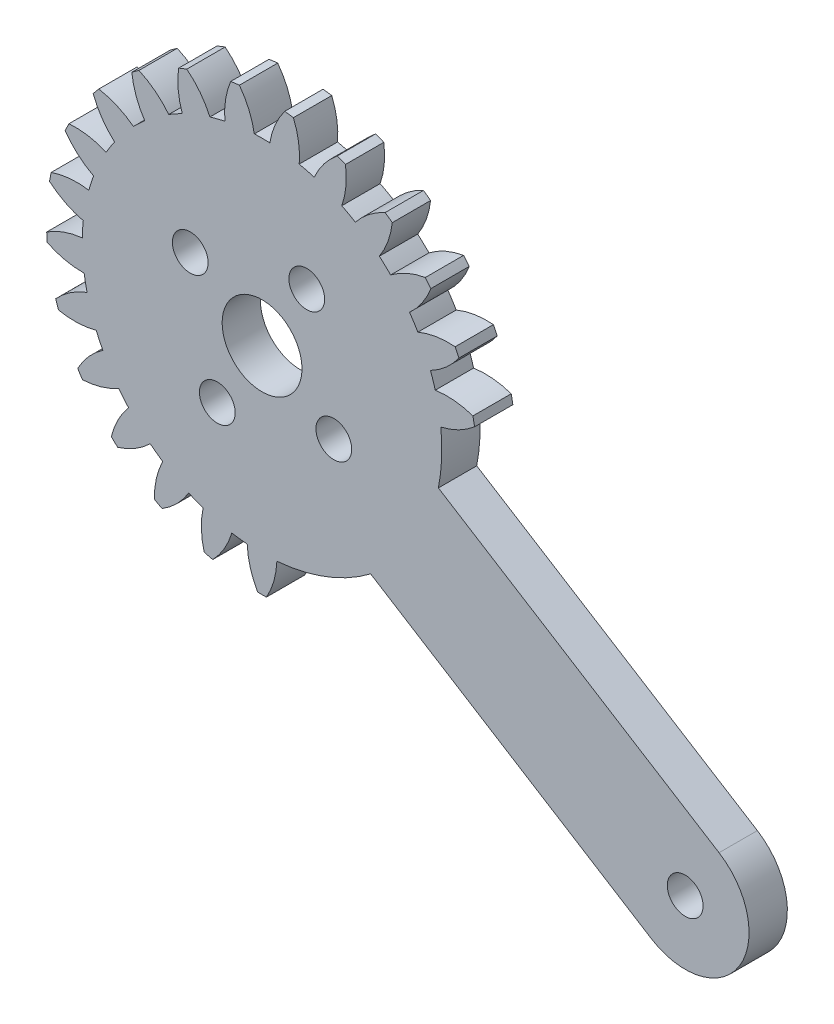
from build123d import *

# Parameters (mm, degrees)
MODEL_R             = 3.175
BOSS_EXTRUDE1_DEPTH = 3.048
SKETCH2_R           = 1.4224
BOSS_EXTRUDE2_DEPTH = 3.048
SKETCH3_R           = 1.4224
SKETCH3_R_2         = 0.475
CUT_EXTRUDE1_DEPTH  = 47.828124767


with BuildPart() as part:
    # Model → Boss-Extrude1 (new body)
    with BuildSketch(Plane.XY):
        with BuildLine():
            ThreePointArc((-0.616026415, 14.286925194), (-1.042592722, 15.739677645), (-1.800954663, 17.050149187))
            ThreePointArc((-1.800954663, 17.050149187), (-2.148838289, 17.009806554), (-2.495825317, 16.962366609))
            ThreePointArc((-2.495825317, 16.962366609), (-2.904460903, 15.504468994), (-2.956341002, 13.991274707))
            ThreePointArc((-2.956341002, 13.991274707), (-3.556315124, 13.850932921), (-4.149686627, 13.684875627))
            ThreePointArc((-4.149686627, 13.684875627), (-4.924136412, 14.985904462), (-5.984574038, 16.066608185))
            ThreePointArc((-5.984574038, 16.066608185), (-6.311495456, 15.941017851), (-6.635783413, 15.808776154))
            ThreePointArc((-6.635783413, 15.808776154), (-6.669016568, 14.295057536), (-6.342950641, 12.816500973))
            ThreePointArc((-6.342950641, 12.816500973), (-6.88917389, 12.531360786), (-7.422606766, 12.222954996))
            ThreePointArc((-7.422606766, 12.222954996), (-8.496278501, 13.290511787), (-9.792160616, 14.073543103))
            ThreePointArc((-9.792160616, 14.073543103), (-10.077578151, 13.870596369), (-10.358790833, 13.661862153))
            ThreePointArc((-10.358790833, 13.661862153), (-10.014533394, 12.187435039), (-9.331009364, 10.836419348))
            ThreePointArc((-9.331009364, 10.836419348), (-9.789160524, 10.424397166), (-10.229137224, 9.993021149))
            ThreePointArc((-10.229137224, 9.993021149), (-11.534568165, 10.760027378), (-12.98446973, 11.196185548))
            ThreePointArc((-12.98446973, 11.196185548), (-13.210449547, 10.928634304), (-13.430917328, 10.656523107))
            ThreePointArc((-13.430917328, 10.656523107), (-12.730800257, 9.314031176), (-11.732766451, 8.175445642))
            ThreePointArc((-11.732766451, 8.175445642), (-12.0740582, 7.662430334), (-12.39293337, 7.135189032))
            ThreePointArc((-12.39293337, 7.135189032), (-13.84809849, 7.553450876), (-15.360916858, 7.615330478))
            ThreePointArc((-15.360916858, 7.615330478), (-15.513259815, 7.299985954), (-15.659129891, 6.981595523))
            ThreePointArc((-15.659129891, 6.981595523), (-14.647144119, 5.85539248), (-13.397310672, 5.000778618))
            ThreePointArc((-13.397310672, 5.000778618), (-13.600298394, 4.419004823), (-13.778035935, 3.829026746))
            ThreePointArc((-13.778035935, 3.829026746), (-15.291501858, 3.872263276), (-16.772181085, 3.555976188))
            ThreePointArc((-16.772181085, 3.555976188), (-16.841314914, 3.212652639), (-16.903421733, 2.867988616))
            ThreePointArc((-16.903421733, 2.867988616), (-15.643154047, 2.02883794), (-14.220052592, 1.511894283))
            ThreePointArc((-14.220052592, 1.511894283), (-14.271981822, 0.897916987), (-14.297413829, 0.282272628))
            ThreePointArc((-14.297413829, 0.282272628), (-15.774083925, -0.052232867), (-17.129587491, -0.726813165))
            ThreePointArc((-17.129587491, -0.726813165), (-17.111168259, -1.076543457), (-17.085609422, -1.425824564))
            ThreePointArc((-17.085609422, -1.425824564), (-15.656247076, -1.92519595), (-14.14929631, -2.071987931))
            ThreePointArc((-14.14929631, -2.071987931), (-14.046904143, -2.679590275), (-13.918432631, -3.282217718))
            ThreePointArc((-13.918432631, -3.282217718), (-15.265522286, -3.973447027), (-16.410678917, -4.963934173))
            ThreePointArc((-16.410678917, -4.963934173), (-16.305863972, -5.298096369), (-16.194245434, -5.630047943))
            ThreePointArc((-16.194245434, -5.630047943), (-14.68560052, -5.758262697), (-13.189487703, -5.525679522))
            ThreePointArc((-13.189487703, -5.525679522), (-12.939207816, -6.088729025), (-12.664905121, -6.640474253))
            ThreePointArc((-12.664905121, -6.640474253), (-13.797771739, -7.644994897), (-14.660627033, -8.889152941))
            ThreePointArc((-14.660627033, -8.889152941), (-14.476002283, -9.1867504), (-14.285337446, -9.480514703))
            ThreePointArc((-14.285337446, -9.480514703), (-12.792203675, -9.229516622), (-11.400935076, -8.632172348))
            ThreePointArc((-11.400935076, -8.632172348), (-11.018493474, -9.115290538), (-10.615595045, -9.581485369))
            ThreePointArc((-10.615595045, -9.581485369), (-11.46305645, -10.836179621), (-11.989394033, -12.255833538))
            ThreePointArc((-11.989394033, -12.255833538), (-11.736560131, -12.498167117), (-11.47882917, -12.735285858))
            ThreePointArc((-11.47882917, -12.735285858), (-10.095025626, -12.120846074), (-8.896019768, -11.196274037))
            ThreePointArc((-8.896019768, -11.196274037), (-8.405446665, -11.569104823), (-7.899268091, -11.920456521))
            ThreePointArc((-7.899268091, -11.920456521), (-8.408075165, -13.346487327), (-8.564823313, -14.85243504))
            ThreePointArc((-8.564823313, -14.85243504), (-8.259666742, -15.024278029), (-7.95106384, -15.189852165))
            ThreePointArc((-7.95106384, -15.189852165), (-6.76353999, -14.25057819), (-5.832134822, -13.056872652))
            ThreePointArc((-5.832134822, -13.056872652), (-5.264254728, -13.295989703), (-4.686601071, -13.510421549))
            ThreePointArc((-4.686601071, -13.510421549), (-4.824783595, -15.018186149), (-4.602093245, -16.515803425))
            ThreePointArc((-4.602093245, -16.515803425), (-4.263788115, -16.606358298), (-3.923703928, -16.689984197))
            ThreePointArc((-3.923703928, -16.689984197), (-3.007076261, -15.484894068), (-2.401795395, -14.097059939))
            ThreePointArc((-2.401795395, -14.097059939), (-1.792290307, -14.187438652), (-1.17945767, -14.251477104))
            ThreePointArc((-1.17945767, -14.251477104), (-0.938333127, -15.746237102), (-0.350196733, -17.14142314))
            ThreePointArc((-0.350196733, -17.14142314), (0, -17.145), (0.350196733, -17.14142314))
            ThreePointArc((0.350196733, -17.14142314), (0.938333127, -15.746237102), (1.17945767, -14.251477104))
            ThreePointArc((1.17945767, -14.251477104), (11.018493474, -9.115290538), (14.220052592, 1.511894283))
            ThreePointArc((14.220052592, 1.511894283), (15.643154047, 2.02883794), (16.903421733, 2.867988616))
            ThreePointArc((16.903421733, 2.867988616), (16.841314914, 3.212652639), (16.772181085, 3.555976188))
            ThreePointArc((16.772181085, 3.555976188), (15.291501858, 3.872263276), (13.778035935, 3.829026746))
            ThreePointArc((13.778035935, 3.829026746), (13.600298394, 4.419004823), (13.397310672, 5.000778619))
            ThreePointArc((13.397310672, 5.000778618), (14.647144119, 5.85539248), (15.659129891, 6.981595523))
            ThreePointArc((15.659129891, 6.981595523), (15.513259815, 7.299985954), (15.360916858, 7.615330478))
            ThreePointArc((15.360916858, 7.615330478), (13.84809849, 7.553450876), (12.39293337, 7.135189032))
            ThreePointArc((12.39293337, 7.135189032), (12.0740582, 7.662430334), (11.732766451, 8.175445642))
            ThreePointArc((11.732766451, 8.175445642), (12.730800257, 9.314031176), (13.430917328, 10.656523107))
            ThreePointArc((13.430917328, 10.656523107), (13.210449547, 10.928634304), (12.98446973, 11.196185548))
            ThreePointArc((12.98446973, 11.196185548), (11.534568165, 10.760027378), (10.229137224, 9.993021149))
            ThreePointArc((10.229137224, 9.993021149), (9.789160524, 10.424397166), (9.331009364, 10.836419348))
            ThreePointArc((9.331009364, 10.836419348), (10.014533394, 12.187435039), (10.358790833, 13.661862153))
            ThreePointArc((10.358790833, 13.661862153), (10.077578151, 13.870596369), (9.792160616, 14.073543103))
            ThreePointArc((9.792160616, 14.073543103), (8.496278501, 13.290511787), (7.422606766, 12.222954996))
            ThreePointArc((7.422606766, 12.222954996), (6.88917389, 12.531360786), (6.342950641, 12.816500974))
            ThreePointArc((6.342950641, 12.816500973), (6.669016568, 14.295057536), (6.635783413, 15.808776154))
            ThreePointArc((6.635783413, 15.808776154), (6.311495456, 15.941017851), (5.984574038, 16.066608185))
            ThreePointArc((5.984574038, 16.066608185), (4.924136412, 14.985904462), (4.149686627, 13.684875627))
            ThreePointArc((4.149686627, 13.684875628), (3.556315124, 13.850932921), (2.956341002, 13.991274707))
            ThreePointArc((2.956341002, 13.991274707), (2.904460903, 15.504468994), (2.495825317, 16.962366609))
            ThreePointArc((2.495825317, 16.962366609), (2.148838289, 17.009806554), (1.800954663, 17.050149187))
            ThreePointArc((1.800954663, 17.050149187), (1.042592722, 15.739677645), (0.616026415, 14.286925194))
            ThreePointArc((0.616026415, 14.286925194), (0, 14.3002), (-0.616026415, 14.286925194))
        make_face()
        with Locations(Location((0, 0, 0), (0, 0, 180))):
            Circle(MODEL_R, mode=Mode.SUBTRACT)
    extrude(amount=BOSS_EXTRUDE1_DEPTH)

    # Sketch2 → Boss-Extrude2 (add)
    with BuildSketch(Plane(origin=(0, 0, 0), x_dir=(-1, 0, 0), z_dir=(0, 0, -1))):
        with BuildLine():
            Line((-30.964694704, -25.359415647), (-8.63932874, -11.395513106))
            ThreePointArc((-8.63932874, -11.395513106), (-12.123969987, -7.58320986), (-14.027044449, -2.781680078))
            Line((-14.027044449, -2.781680078), (-36.352410413, -16.745582618))
            ThreePointArc((-36.352410413, -16.745582618), (-37.965469072, -23.746356987), (-30.964694704, -25.359415647))
        make_face()
        with Locations((-33.658552558, -21.052499132)):
            Circle(SKETCH2_R, mode=Mode.SUBTRACT)
    extrude(amount=-BOSS_EXTRUDE2_DEPTH)

    # Sketch3 → Cut-Extrude1 (cut, through all)
    # profile 1 of 6: a face of its own
    with BuildSketch(Plane.XY.offset(3.048)):
        with Locations((-5.710055654, 3.571482805)):
            Circle(SKETCH3_R)
        with Locations((-5.710055654, 3.571482805)):
            Circle(SKETCH3_R_2, mode=Mode.SUBTRACT)
    # profile 2 of 6: a face of its own
    with BuildSketch(Plane.XY.offset(3.048)):
        with Locations((3.557960487, 5.68843629)):
            Circle(SKETCH3_R)
        with Locations((3.557960487, 5.68843629)):
            Circle(SKETCH3_R_2, mode=Mode.SUBTRACT)
    # profile 3 of 6: a face of its own
    with BuildSketch(Plane.XY.offset(3.048)):
        with Locations((-5.710055654, 3.571482805)):
            Circle(SKETCH3_R_2)
    # profile 4 of 6: a face of its own
    with BuildSketch(Plane.XY.offset(3.048)):
        with Locations((3.557960487, 5.68843629)):
            Circle(SKETCH3_R_2)
    # profile 5 of 6: a face of its own
    with BuildSketch(Plane.XY.offset(3.048)):
        with Locations((5.710055654, -3.571482805)):
            Circle(SKETCH3_R)
    # profile 6 of 6: a face of its own
    with BuildSketch(Plane.XY.offset(3.048)):
        with Locations((-3.557960487, -5.68843629)):
            Circle(SKETCH3_R)
    extrude(amount=-CUT_EXTRUDE1_DEPTH, mode=Mode.SUBTRACT)


solid = part.part
